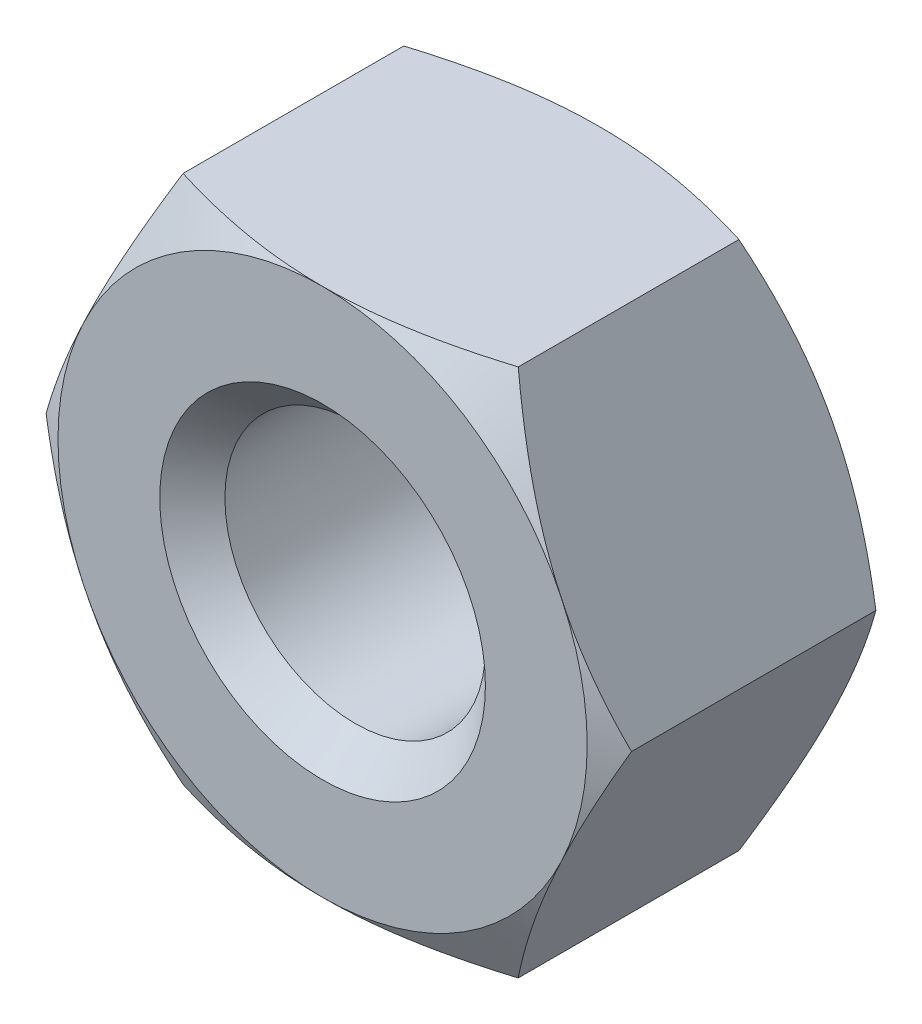
from build123d import *

# Parameters (mm, degrees)
BASE_EXTRUSION_DEPTH    = 6.8
ESQUISSE4_R             = 3.2
ENL_V_MAT_EXTRU_1_DEPTH = 12.840021115
CHANFREIN1_SIZE         = 0.8


with BuildPart() as part:
    # Esquisse1 → Base-Extrusion (new body)
    with BuildSketch(Plane.XY):
        Polygon((-7.19, 0), (-4.116549171, 6.5), (4.116549171, 6.5), (7.19, 0), (4.116549171, -6.5), (-4.116549171, -6.5), align=None)
    extrude(amount=BASE_EXTRUSION_DEPTH)

    # Esquisse3 → Enlever de la matière-Révolution1 (revolve, cut)
    with BuildSketch(Plane(origin=(0, 0, 0), x_dir=(0, 0, -1), z_dir=(1, 0, 0)), mode=Mode.PRIVATE) as enlever_de_la_mati_re_r_volution1_sk:
        Polygon((-6.8, 6.5), (-3.4, 12.388972746), (0, 6.5), (2.598076211, 8), (-3.4, 18.388972746), (-9.398076211, 8), align=None)
    revolve(enlever_de_la_mati_re_r_volution1_sk.sketch.rotate(Axis((0, 0, 8.495961775), (0, 0, -1)), 90), axis=Axis((0, 0, 8.495961775), (0, 0, -1)), mode=Mode.SUBTRACT)

    # Esquisse4 → Enlèv. mat.-Extru.1 (cut, through all)
    with BuildSketch(Plane.XY.offset(6.8)):
        Circle(ESQUISSE4_R)
    extrude(amount=-ENL_V_MAT_EXTRU_1_DEPTH, mode=Mode.SUBTRACT)

    # Chanfrein1
    chanfrein1_edges = [part.edges().sort_by_distance(p)[0] for p in [
        (-3.2, 0, 0),
        (-3.2, 0, 6.8),
    ]]
    chamfer(chanfrein1_edges, length=CHANFREIN1_SIZE)


solid = part.part
